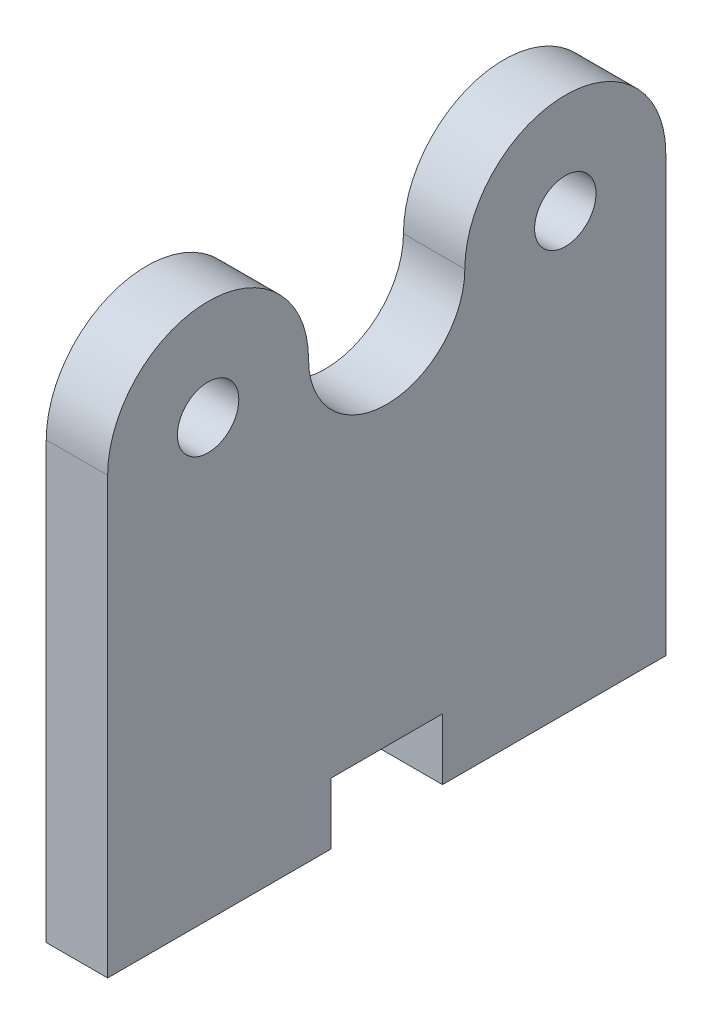
from build123d import *

# Parameters (mm, degrees)
CROQUIS1_R              = 2.75
SALIENTE_EXTRUIR1_DEPTH = 5.5


with BuildPart() as part:
    # Croquis1 → Saliente-Extruir1 (new body)
    with BuildSketch(Plane(origin=(0, 0, 0), x_dir=(0, 0, -1), z_dir=(1, 0, 0))):
        with BuildLine():
            Line((-25, 0), (-25, -33.5))
            Line((-25, -33.5), (-25, -39))
            Line((-25, -39), (-5, -39))
            Line((-5, -39), (-5, -33.5))
            Line((-5, -33.5), (5, -33.5))
            Line((5, -33.5), (5, -39))
            Line((5, -39), (25, -39))
            Line((25, -39), (25, -33.5))
            Line((25, -33.5), (25, 0))
            ThreePointArc((25, 0), (16, 9), (7, 0))
            ThreePointArc((7, 0), (0, -7), (-7, 0))
            ThreePointArc((-7, 0), (-16, 9), (-25, 0))
        make_face()
        with Locations((-16, 0)):
            Circle(CROQUIS1_R, mode=Mode.SUBTRACT)
        with Locations((16, 0)):
            Circle(CROQUIS1_R, mode=Mode.SUBTRACT)
    extrude(amount=SALIENTE_EXTRUIR1_DEPTH)


solid = part.part
